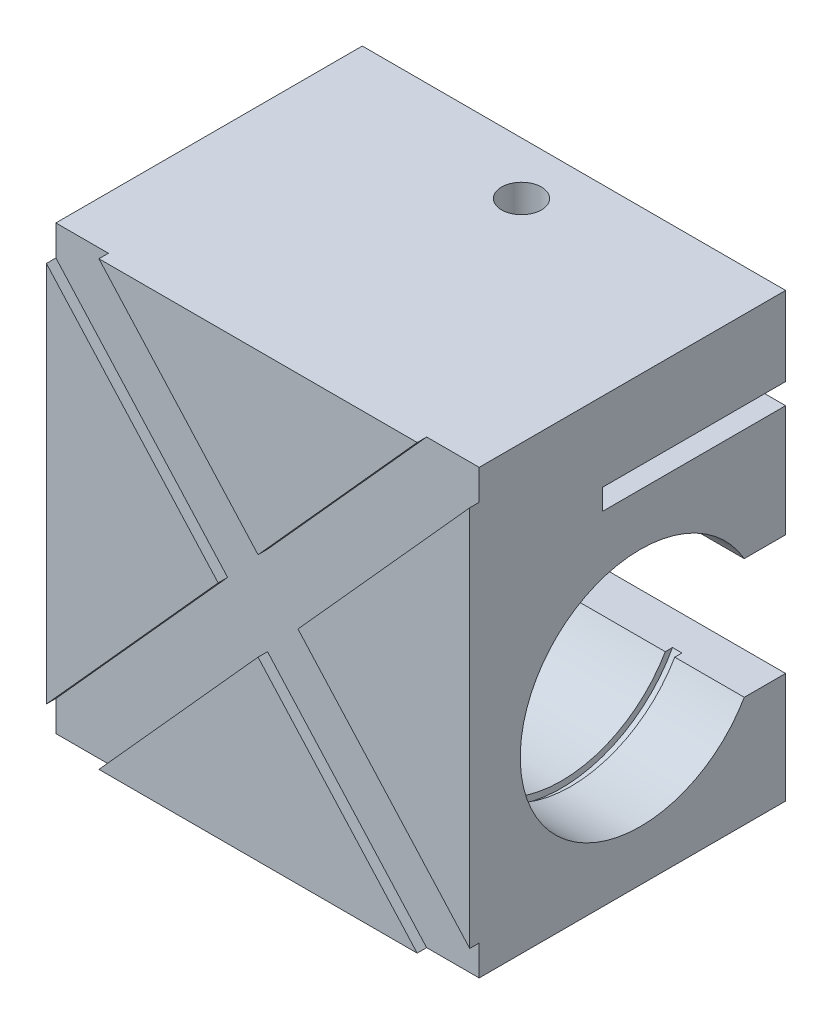
from build123d import *

# Parameters (mm, degrees)
SKETCH1_W           = 67
SKETCH1_H           = 50
BOSS_EXTRUDE1_DEPTH = 70
SKETCH3_W           = 29
SKETCH3_H           = 3.3
CUT_EXTRUDE1_DEPTH  = 67
SKETCH4_R           = 20
CUT_EXTRUDE2_DEPTH  = 1.5
CUT_EXTRUDE3_START  = -1.5
SKETCH5_R           = 20
CUT_EXTRUDE3_DEPTH  = 1.5
SKETCH7_R           = 3.15
CUT_EXTRUDE4_DEPTH  = 12.5
CUT_EXTRUDE5_DEPTH  = 1.5


with BuildPart() as part:
    # Sketch1 → Boss-Extrude1 (new body)
    with BuildSketch(Plane(origin=(0, 0, 0), x_dir=(1, 0, 0), z_dir=(0, 1, 0))):
        Rectangle(SKETCH1_W, SKETCH1_H)
    extrude(amount=BOSS_EXTRUDE1_DEPTH)

    # Sketch3 → Cut-Extrude1 (cut)
    with BuildSketch(Plane(origin=(33.5, 0, 0), x_dir=(0, 0, -1), z_dir=(1, 0, 0))):
        with Locations((10.5, 55.85)):
            Rectangle(SKETCH3_W, SKETCH3_H)
        with BuildLine():
            Line((25, 36.5), (25, 17.5))
            Line((25, 17.5), (18.454482672, 17.5))
            ThreePointArc((18.454482672, 17.5), (-17, 27), (18.454482672, 36.5))
            Line((18.454482672, 36.5), (25, 36.5))
        make_face()
    extrude(amount=-CUT_EXTRUDE1_DEPTH, mode=Mode.SUBTRACT)

    # Sketch4 → Cut-Extrude2 (cut)
    with BuildSketch(Plane(origin=(21, 0, 0), x_dir=(0, 0, -1), z_dir=(1, 0, 0))):
        with Locations((2, 27)):
            Circle(SKETCH4_R)
    extrude(amount=CUT_EXTRUDE2_DEPTH, mode=Mode.SUBTRACT)

    # Sketch5 → Cut-Extrude3 (cut)
    with BuildSketch(Plane(origin=(-21, 0, 0), x_dir=(0, 0, -1), z_dir=(1, 0, 0)).offset(CUT_EXTRUDE3_START)):
        with Locations((2, 27)):
            Circle(SKETCH5_R)
    extrude(amount=CUT_EXTRUDE3_DEPTH, mode=Mode.SUBTRACT)

    # Sketch7 → Cut-Extrude4 (cut)
    with BuildSketch(Plane(origin=(0, 70, 0), x_dir=(1, 0, 0), z_dir=(0, 1, 0))):
        with Locations(Location((0, 16.7, 0), (0, 0, 270))):
            Circle(SKETCH7_R)
    extrude(amount=-CUT_EXTRUDE4_DEPTH, mode=Mode.SUBTRACT)

    # Sketch9 → Cut-Extrude5 (cut)
    with BuildSketch(Plane.XY.offset(25)):
        Polygon((-33.5, 0), (-33.5, 4.8), (-6.317148544, 35), (-33.5, 65.2), (-33.5, 70), (-25.186156124, 70), (0, 42.018317645), (25.186156124, 70), (33.5, 70), (33.5, 65.2), (6.317148544, 35), (33.5, 4.8), (33.5, 0), (25.186156124, 0), (0, 27.981682355), (-25.186156124, 0), align=None)
    extrude(amount=-CUT_EXTRUDE5_DEPTH, mode=Mode.SUBTRACT)


solid = part.part
